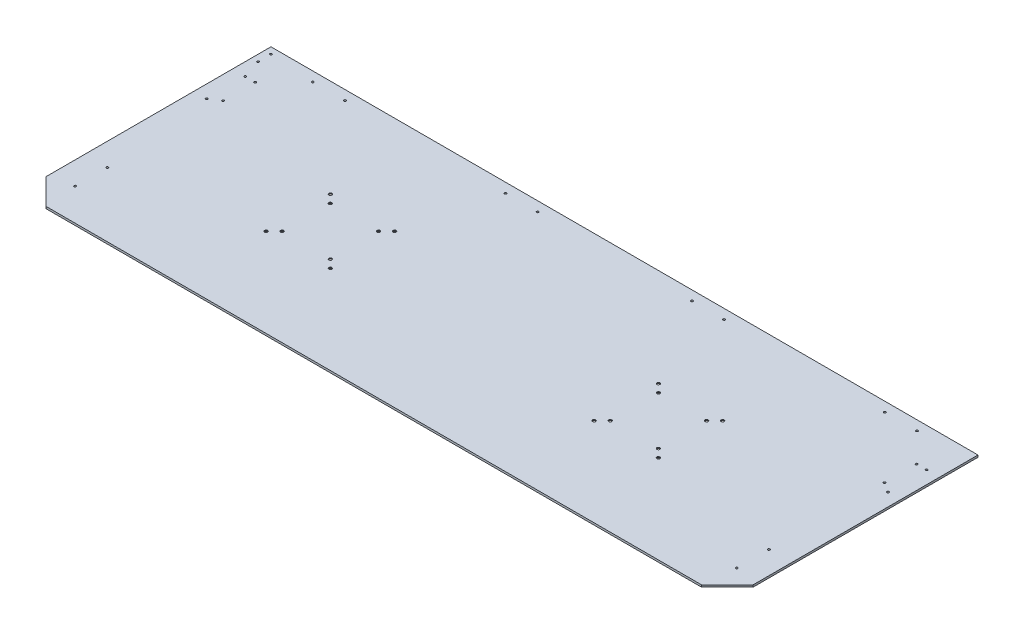
from build123d import *

# Parameters (mm, degrees)
SKETCH1_W                 = 1100
SKETCH1_H                 = 390
PLATE_DEPTH               = 3.175
MONITOR_HOLES_AT_2_COUNT  = 2
MONITOR_HOLES_AT_2_PITCH  = 106.066017178
MONITOR_HOLES_AT_3_COUNT  = 2
MONITOR_HOLES_AT_3_PITCH  = 75
MONITOR_HOLES_AT_4_COUNT  = 2
MONITOR_HOLES_AT_4_PITCH  = 75
MONITOR_HOLES_AT_5_COUNT  = 2
MONITOR_HOLES_AT_5_PITCH  = 17.67766953
MONITOR_HOLES_AT_6_COUNT  = 2
MONITOR_HOLES_AT_6_PITCH  = 123.743686708
MONITOR_HOLES_AT_7_COUNT  = 2
MONITOR_HOLES_AT_7_PITCH  = 88.388347648
MONITOR_HOLES_AT_8_COUNT  = 2
MONITOR_HOLES_AT_8_PITCH  = 88.388347648
MONITOR_HOLES_AT_9_COUNT  = 2
MONITOR_HOLES_AT_9_PITCH  = 510.4
MONITOR_HOLES_AT_10_COUNT = 2
MONITOR_HOLES_AT_10_PITCH = 435.4
MONITOR_HOLES_AT_11_COUNT = 2
MONITOR_HOLES_AT_11_PITCH = 515.88095526
MONITOR_HOLES_AT_12_COUNT = 2
MONITOR_HOLES_AT_12_PITCH = 441.81235836
MONITOR_HOLES_AT_13_COUNT = 2
MONITOR_HOLES_AT_13_PITCH = 530.170406568
MONITOR_HOLES_AT_14_COUNT = 2
MONITOR_HOLES_AT_14_PITCH = 431.857221776
MONITOR_HOLES_AT_15_COUNT = 2
MONITOR_HOLES_AT_15_PITCH = 523.049385814
MONITOR_HOLES_AT_16_COUNT = 2
MONITOR_HOLES_AT_16_PITCH = 423.084696013
STRUT_HOLES_D             = 3.3
GLARE_PROTECTOR_HOLES_D   = 3.3
CHAMFER1_SIZE             = 40
ANTENNA_HOLES_D           = 3.3


with BuildPart() as part:
    # Sketch1 → Plate (new body)
    with BuildSketch(Plane(origin=(0, 0, 0), x_dir=(1, 0, 0), z_dir=(0, 1, 0))):
        Rectangle(SKETCH1_W, SKETCH1_H)
    extrude(amount=PLATE_DEPTH)

    # Sketch7 → Monitor Holes (revolve, cut)
    with BuildSketch(Plane(origin=(217.7, 0, -30.1), x_dir=(0, 0, -1), z_dir=(1, 0, 0))):
        Polygon((0, 0), (0, 3.175), (2.4, 3.175), (2.4, 2.08), (4.48, 0), align=None)
    monitor_holes = revolve(axis=Axis((217.7, -6.35, -30.1), (0, 1, 0)), mode=Mode.SUBTRACT)

    # Monitor Holes at 2: Monitor Holes ×2
    with Locations(*[Vector(0.7071067811865477, 0, 0.7071067811865474) * (i * MONITOR_HOLES_AT_2_PITCH) for i in range(1, MONITOR_HOLES_AT_2_COUNT)]):
        add(monitor_holes, mode=Mode.SUBTRACT)

    # Monitor Holes at 3: Monitor Holes ×2
    with Locations(*[(i * MONITOR_HOLES_AT_3_PITCH, 0, 0) for i in range(1, MONITOR_HOLES_AT_3_COUNT)]):
        add(monitor_holes, mode=Mode.SUBTRACT)

    # Monitor Holes at 4: Monitor Holes ×2
    with Locations(*[(0, 0, i * MONITOR_HOLES_AT_4_PITCH) for i in range(1, MONITOR_HOLES_AT_4_COUNT)]):
        add(monitor_holes, mode=Mode.SUBTRACT)

    # Monitor Holes at 5: Monitor Holes ×2
    with Locations(*[Vector(-0.7071067811865468, 0, -0.7071067811865483) * (i * MONITOR_HOLES_AT_5_PITCH) for i in range(1, MONITOR_HOLES_AT_5_COUNT)]):
        add(monitor_holes, mode=Mode.SUBTRACT)

    # Monitor Holes at 6: Monitor Holes ×2
    with Locations(*[Vector(0.7071067811865478, 0, 0.7071067811865474) * (i * MONITOR_HOLES_AT_6_PITCH) for i in range(1, MONITOR_HOLES_AT_6_COUNT)]):
        add(monitor_holes, mode=Mode.SUBTRACT)

    # Monitor Holes at 7: Monitor Holes ×2
    with Locations(*[Vector(0.9899494936611666, 0, -0.1414213562373094) * (i * MONITOR_HOLES_AT_7_PITCH) for i in range(1, MONITOR_HOLES_AT_7_COUNT)]):
        add(monitor_holes, mode=Mode.SUBTRACT)

    # Monitor Holes at 8: Monitor Holes ×2
    with Locations(*[Vector(-0.14142135623730914, 0, 0.9899494936611667) * (i * MONITOR_HOLES_AT_8_PITCH) for i in range(1, MONITOR_HOLES_AT_8_COUNT)]):
        add(monitor_holes, mode=Mode.SUBTRACT)

    # Monitor Holes at 9: Monitor Holes ×2
    with Locations(*[(-i * MONITOR_HOLES_AT_9_PITCH, 0, 0) for i in range(1, MONITOR_HOLES_AT_9_COUNT)]):
        add(monitor_holes, mode=Mode.SUBTRACT)

    # Monitor Holes at 10: Monitor Holes ×2
    with Locations(*[(-i * MONITOR_HOLES_AT_10_PITCH, 0, 0) for i in range(1, MONITOR_HOLES_AT_10_COUNT)]):
        add(monitor_holes, mode=Mode.SUBTRACT)

    # Monitor Holes at 11: Monitor Holes ×2
    with Locations(*[Vector(-0.989375542546892, 0, 0.14538237792127132) * (i * MONITOR_HOLES_AT_11_PITCH) for i in range(1, MONITOR_HOLES_AT_11_COUNT)]):
        add(monitor_holes, mode=Mode.SUBTRACT)

    # Monitor Holes at 12: Monitor Holes ×2
    with Locations(*[Vector(-0.9854862403934994, 0, 0.16975532390792936) * (i * MONITOR_HOLES_AT_12_PITCH) for i in range(1, MONITOR_HOLES_AT_12_COUNT)]):
        add(monitor_holes, mode=Mode.SUBTRACT)

    # Monitor Holes at 13: Monitor Holes ×2
    with Locations(*[Vector(-0.9862866608971649, 0, 0.16504127525052958) * (i * MONITOR_HOLES_AT_13_PITCH) for i in range(1, MONITOR_HOLES_AT_13_COUNT)]):
        add(monitor_holes, mode=Mode.SUBTRACT)

    # Monitor Holes at 14: Monitor Holes ×2
    with Locations(*[Vector(-0.9792588352718359, 0, 0.2026132610221935) * (i * MONITOR_HOLES_AT_14_PITCH) for i in range(1, MONITOR_HOLES_AT_14_COUNT)]):
        add(monitor_holes, mode=Mode.SUBTRACT)

    # Monitor Holes at 15: Monitor Holes ×2
    with Locations(*[Vector(-0.9997143944383325, 0, -0.023898316944882675) * (i * MONITOR_HOLES_AT_15_PITCH) for i in range(1, MONITOR_HOLES_AT_15_COUNT)]):
        add(monitor_holes, mode=Mode.SUBTRACT)

    # Monitor Holes at 16: Monitor Holes ×2
    with Locations(*[Vector(-0.9995634538090055, 0, -0.029544911734718758) * (i * MONITOR_HOLES_AT_16_PITCH) for i in range(1, MONITOR_HOLES_AT_16_COUNT)]):
        add(monitor_holes, mode=Mode.SUBTRACT)

    # Strut Holes (through all)
    with Locations(Plane(origin=(0, 3.175, 0), x_dir=(1, 0, 0), z_dir=(0, 1, 0))):
        with Locations((-530, 135), (-530, 75), (530, 135), (530, 75)):
            Hole(STRUT_HOLES_D / 2)

    # Glare Protector Holes (through all)
    with Locations(Plane(origin=(0, 3.175, 0), x_dir=(1, 0, 0), z_dir=(0, 1, 0))):
        with Locations((-514.6, 135), (-514.6, 85), (-514.6, -145), (-514.6, -95), (-470, 180), (-420, 180), (-170, 180), (-120, 180), (420, 180), (470, 180), (120, 180), (170, 180), (514.6, 135), (514.6, 85), (514.6, -145), (514.6, -95)):
            Hole(GLARE_PROTECTOR_HOLES_D / 2)

    # Chamfer1
    chamfer1_edges = [part.edges().sort_by_distance(p)[0] for p in [
        (550, 1.5875, 195),
        (-550, 1.5875, 195),
    ]]
    chamfer(chamfer1_edges, length=CHAMFER1_SIZE)

    # Antenna Holes (through all)
    with Locations(Plane(origin=(0, 3.175, 0), x_dir=(1, 0, 0), z_dir=(0, 1, 0))):
        with Locations((-540, 165), (-540, 185)):
            Hole(ANTENNA_HOLES_D / 2)


solid = part.part
